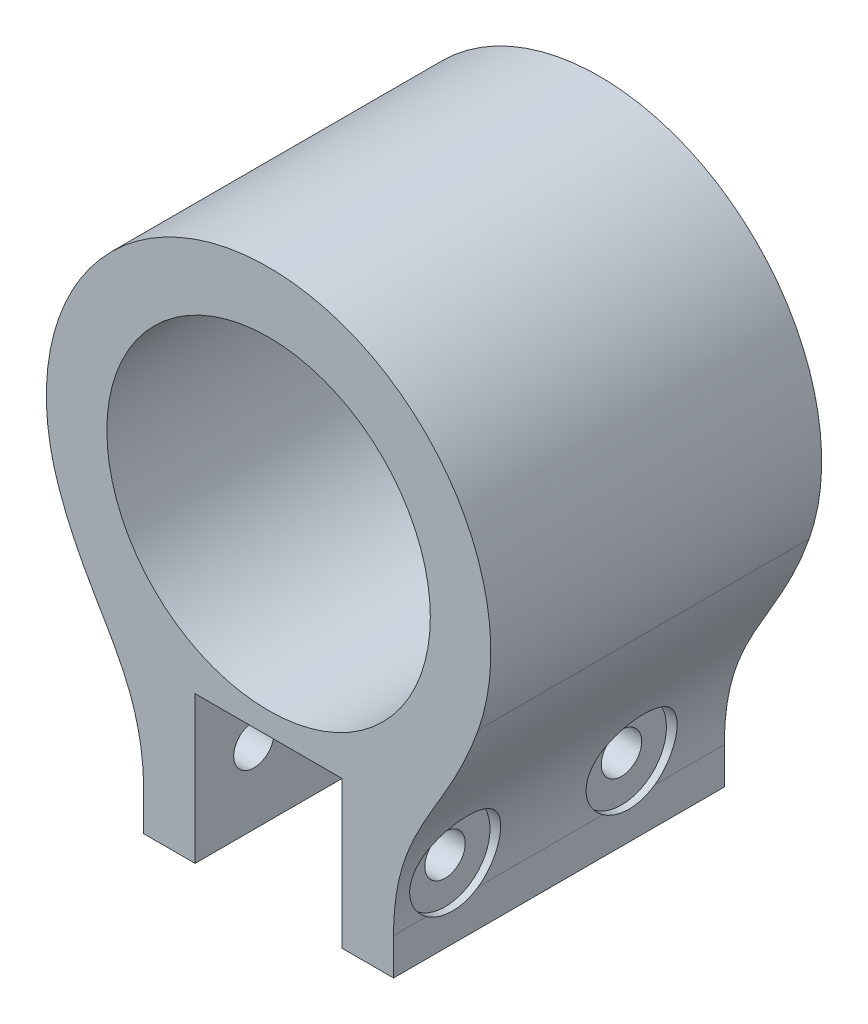
from build123d import *
from build123d.topology import SkipClean

# Parameters (mm, degrees)
SKETCH1_R                              = 22
BOSS_EXTRUDE1_DEPTH                    = 40
CBORE_FOR_M5_HEX_HEAD_BOLT1_AT_2_COUNT = 2
CBORE_FOR_M5_HEX_HEAD_BOLT1_AT_2_PITCH = 24
CUT_EXTRUDE1_DEPTH                     = 90.923150822
BOSS_EXTRUDE2_START                    = 5
SKETCH6_R                              = 9
BOSS_EXTRUDE2_DEPTH                    = 5
M5_CLEARANCE_HOLE1_D                   = 5.5
M5_CLEARANCE_HOLE1_DEPTH               = 12
M5_CLEARANCE_HOLE1_TIP                 = 1.652366702
M4_CLEARANCE_HOLE1_D                   = 4.5
M4_CLEARANCE_HOLE1_DEPTH               = 12
M4_CLEARANCE_HOLE1_TIP                 = 1.351936393
CUT_EXTRUDE2_START                     = -5
SKETCH11_R                             = 2.25
CUT_EXTRUDE2_DEPTH                     = 5


with BuildPart() as part:
    # Sketch1 → Boss-Extrude1 (new body)
    # profile 1 of 7: a face of its own
    with BuildSketch(Plane.XY):
        with BuildLine():
            Line((-17, 10), (-10, 10))
            Line((-10, 10), (10, 10))
            Line((10, 10), (17, 10))
            ThreePointArc((17, 10), (23.968955432, 16.574767966), (28.530685235, 25))
            ThreePointArc((28.530685235, 25), (29.803959698, 29.928118072), (30.232432916, 35))
            ThreePointArc((30.232432916, 35), (-5.071881928, 64.803959698), (-28.530685235, 25))
            ThreePointArc((-28.530685235, 25), (-23.968955432, 16.574767966), (-17, 10))
        make_face()
        with Locations((0, 35)):
            Circle(SKETCH1_R, mode=Mode.SUBTRACT)
    # profile 2 of 7: a face of its own
    with BuildSketch(Plane.XY):
        with BuildLine():
            Line((-17, -5), (-17, 10))
            ThreePointArc((-17, 10), (-23.968955432, 16.574767966), (-28.530685235, 25))
            add(Edge.make_bspline(
                [(-28.530685235, 25), (-24.136929726, 12.464314457), (-17, 8.619402075), (-17, -5)],
                knots=[0, 0, 0, 0, 1, 1, 1, 1], degree=3))
        make_face()
    # profile 3 of 7: a face of its own
    with BuildSketch(Plane.XY):
        with BuildLine():
            Line((-17, -10), (-10, -10))
            Line((-10, -10), (-10, 6.469314765))
            ThreePointArc((-10, 6.469314765), (-13.614934247, 8.006786678), (-17, 10))
            Line((-17, 10), (-17, -5))
            Line((-17, -5), (-17, -10))
        make_face()
    # profile 4 of 7: a face of its own
    with BuildSketch(Plane.XY):
        with BuildLine():
            Line((10, 6.469314765), (10, -10))
            Line((10, -10), (17, -10))
            Line((17, -10), (17, -5))
            Line((17, -5), (17, 10))
            ThreePointArc((17, 10), (13.614934247, 8.006786678), (10, 6.469314765))
        make_face()
    # profile 5 of 7: a face of its own
    with BuildSketch(Plane.XY):
        with BuildLine():
            ThreePointArc((28.530685235, 25), (23.968955432, 16.574767966), (17, 10))
            Line((17, 10), (17, -5))
            add(Edge.make_bspline(
                [(28.530685235, 25), (24.136929726, 12.464314457), (17, 8.619402075), (17, -5)],
                knots=[0, 0, 0, 0, 1, 1, 1, 1], degree=3))
        make_face()
    # profile 6 of 7: a face of its own
    with BuildSketch(Plane.XY):
        with BuildLine():
            ThreePointArc((-17, 10), (-13.614934247, 8.006786678), (-10, 6.469314765))
            Line((-10, 6.469314765), (-10, 10))
            Line((-10, 10), (-17, 10))
        make_face()
    # profile 7 of 7: a face of its own
    with BuildSketch(Plane.XY):
        with BuildLine():
            Line((10, 10), (10, 6.469314765))
            ThreePointArc((10, 6.469314765), (13.614934247, 8.006786678), (17, 10))
            Line((17, 10), (10, 10))
        make_face()
    extrude(amount=BOSS_EXTRUDE1_DEPTH)

    # Sketch4 → CBORE for M5 Hex Head Bolt1 (revolve, cut)
    with BuildSketch(Plane(origin=(-17, 0, 8), x_dir=(0, 0, 1), z_dir=(0, 1, 0))):
        Polygon((0, 0), (0, 13.652366702), (2.75, 12), (2.75, 1), (6.12, 1), (6.12, 0), align=None)
    cbore_for_m5_hex_head_bolt1 = revolve(axis=Axis((-23.35, 0, 8), (1, 0, 0)), mode=Mode.SUBTRACT)

    # CBORE for M5 Hex Head Bolt1 at 2: CBORE for M5 Hex Head Bolt1 ×2
    with Locations(*[(0, 0, i * CBORE_FOR_M5_HEX_HEAD_BOLT1_AT_2_PITCH) for i in range(1, CBORE_FOR_M5_HEX_HEAD_BOLT1_AT_2_COUNT)]):
        add(cbore_for_m5_hex_head_bolt1, mode=Mode.SUBTRACT)

    # Sketch5 → Cut-Extrude1 (cut, through all)
    with BuildSketch(Plane.ZY.offset(17)):
        with BuildLine():
            ThreePointArc((14.12, 0), (5.184290916, 5.433799992), (4.4709208, -5))
            ThreePointArc((4.4709208, -5), (8, -6.12), (11.5290792, -5))
            ThreePointArc((11.5290792, -5), (13.433799992, -2.815709084), (14.12, 0))
        make_face()
        with BuildLine():
            ThreePointArc((38.12, 0), (29.184290916, 5.433799992), (28.4709208, -5))
            ThreePointArc((28.4709208, -5), (32, -6.12), (35.5290792, -5))
            ThreePointArc((35.5290792, -5), (37.433799992, -2.815709084), (38.12, 0))
        make_face()
    cut_extrude1 = extrude(amount=CUT_EXTRUDE1_DEPTH, mode=Mode.SUBTRACT)

    # Mirror1: CBORE for M5 Hex Head Bolt1, Cut-Extrude1 across plane
    add(cbore_for_m5_hex_head_bolt1.mirror(Plane(origin=(0, 0, 0), x_dir=(0, 0, 1), z_dir=(1, 0, 0))), mode=Mode.SUBTRACT)
    add(cut_extrude1.mirror(Plane(origin=(0, 0, 0), x_dir=(0, 0, 1), z_dir=(1, 0, 0))), mode=Mode.SUBTRACT)

    # Mirror1 copy 1 sketch → Mirror1 copy 1 (revolve, cut)
    with BuildSketch(Plane(origin=(17, 0, 32), x_dir=(0, 0, 1), z_dir=(0, 1, 0))):
        Polygon((0, 0), (0, -13.652366702), (2.75, -12), (2.75, -1), (6.12, -1), (6.12, 0), align=None)
    revolve(axis=Axis((23.35, 0, 32), (1, 0, 0)), mode=Mode.SUBTRACT)

    # Sketch6 → Boss-Extrude2 (add)
    with SkipClean():  # the faces are left unmerged after this step: merging them gives an invalid solid
        with BuildSketch(Plane(origin=(0, 0, 0), x_dir=(-1, 0, 0), z_dir=(0, 0, -1)).offset(BOSS_EXTRUDE2_START)):
            with BuildLine():
                Line((17, -10), (17, -5))
                add(Edge.make_bspline(
                    [(28.530685235, 25), (24.136929726, 12.464314457), (17, 8.619402075), (17, -5)],
                    knots=[0, 0, 0, 0, 1, 1, 1, 1], degree=3))
                ThreePointArc((28.530685235, 25), (0, 65.232432916), (-28.530685235, 25))
                add(Edge.make_bspline(
                    [(-28.530685235, 25), (-24.136929726, 12.464314457), (-17, 8.619402075), (-17, -5)],
                    knots=[0, 0, 0, 0, 1, 1, 1, 1], degree=3))
                Line((-17, -5), (-17, -10))
                Line((-17, -10), (17, -10))
            make_face()
            with Locations((0, 35)):
                Circle(SKETCH6_R, mode=Mode.SUBTRACT)
        extrude(amount=-BOSS_EXTRUDE2_DEPTH)

    # M5 Clearance Hole1
    with Locations(Plane.XY):
        with Locations((0, 0)):
            Hole(M5_CLEARANCE_HOLE1_D / 2, depth=M5_CLEARANCE_HOLE1_DEPTH)
            with Locations((0, 0, -(M5_CLEARANCE_HOLE1_DEPTH + M5_CLEARANCE_HOLE1_TIP / 2))):  # 118° drill point
                Cone(0, M5_CLEARANCE_HOLE1_D / 2, M5_CLEARANCE_HOLE1_TIP, mode=Mode.SUBTRACT)

    # M4 Clearance Hole1
    with Locations(Plane(origin=(0, 0, -5), x_dir=(-1, 0, 0), z_dir=(0, 0, -1))):
        with Locations((-14.5, 35), (14.5, 35), (0, 35)):
            Hole(M4_CLEARANCE_HOLE1_D / 2, depth=M4_CLEARANCE_HOLE1_DEPTH)
            with Locations((0, 0, -(M4_CLEARANCE_HOLE1_DEPTH + M4_CLEARANCE_HOLE1_TIP / 2))):  # 118° drill point
                Cone(0, M4_CLEARANCE_HOLE1_D / 2, M4_CLEARANCE_HOLE1_TIP, mode=Mode.SUBTRACT)

    # Sketch11 → Cut-Extrude2 (cut)
    with SkipClean():  # the faces are left unmerged after this step: merging them gives an invalid solid
        with BuildSketch(Plane(origin=(0, 0, -5), x_dir=(-1, 0, 0), z_dir=(0, 0, -1)).offset(CUT_EXTRUDE2_START)):
            with Locations((-14.5, 35)):
                Circle(SKETCH11_R)
            with BuildLine():
                ThreePointArc((-9.287155609, 49.238986646), (-12.02081528, 47.02081528), (-14.238986646, 44.287155609))
                ThreePointArc((-14.238986646, 44.287155609), (-13.510776199, 40.827428807), (-10.051049397, 41.555639253))
                ThreePointArc((-10.051049397, 41.555639253), (-8.485281374, 43.485281374), (-6.555639253, 45.051049397))
                ThreePointArc((-6.555639253, 45.051049397), (-5.827428807, 48.510776199), (-9.287155609, 49.238986646))
            make_face()
            with BuildLine():
                ThreePointArc((10.051049397, 41.555639253), (8.485281374, 43.485281374), (6.555639253, 45.051049397))
                ThreePointArc((6.555639253, 45.051049397), (5.827428807, 48.510776199), (9.287155609, 49.238986646))
                ThreePointArc((9.287155609, 49.238986646), (12.02081528, 47.02081528), (14.238986646, 44.287155609))
                ThreePointArc((14.238986646, 44.287155609), (13.510776199, 40.827428807), (10.051049397, 41.555639253))
            make_face()
            with BuildLine():
                ThreePointArc((6.555639253, 24.948950603), (8.485281374, 26.514718626), (10.051049397, 28.444360747))
                ThreePointArc((10.051049397, 28.444360747), (13.510776199, 29.172571193), (14.238986646, 25.712844391))
                ThreePointArc((14.238986646, 25.712844391), (12.02081528, 22.97918472), (9.287155609, 20.761013354))
                ThreePointArc((9.287155609, 20.761013354), (5.827428807, 21.489223801), (6.555639253, 24.948950603))
            make_face()
            with BuildLine():
                ThreePointArc((-10.051049397, 28.444360747), (-8.485281374, 26.514718626), (-6.555639253, 24.948950603))
                ThreePointArc((-6.555639253, 24.948950603), (-5.827428807, 21.489223801), (-9.287155609, 20.761013354))
                ThreePointArc((-9.287155609, 20.761013354), (-12.02081528, 22.97918472), (-14.238986646, 25.712844391))
                ThreePointArc((-14.238986646, 25.712844391), (-13.510776199, 29.172571193), (-10.051049397, 28.444360747))
            make_face()
        extrude(amount=CUT_EXTRUDE2_DEPTH, mode=Mode.SUBTRACT)


solid = part.part
